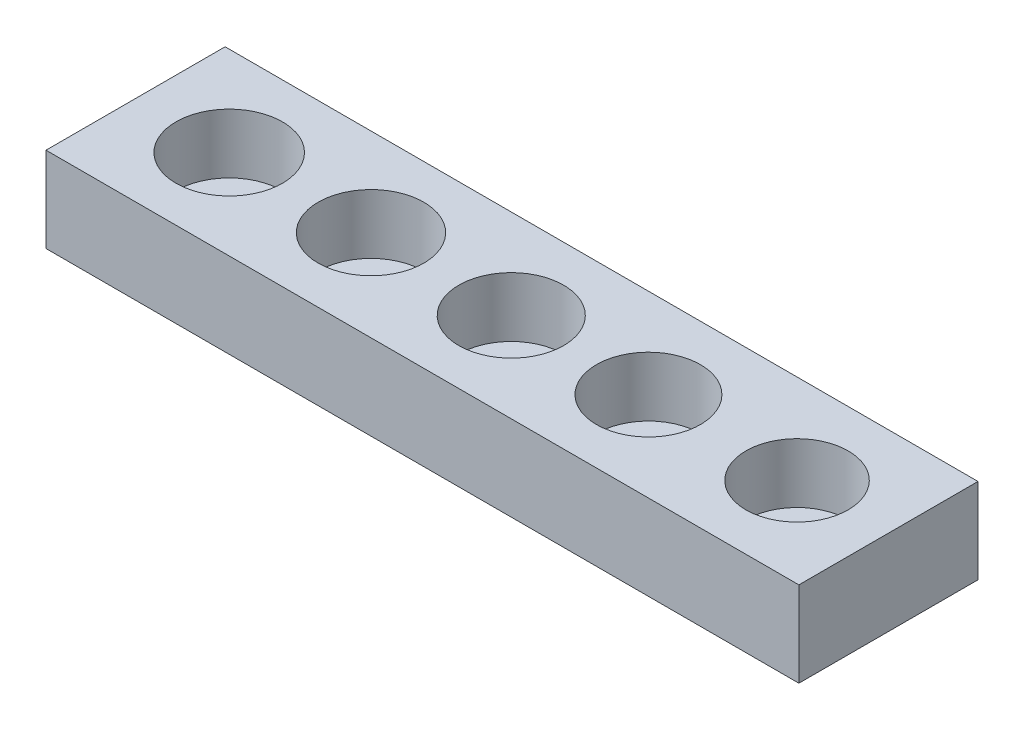
from build123d import *

# Parameters (mm, degrees)
SKETCH4_W           = 44.183790648
SKETCH4_H           = 10.51168125
BOSS_EXTRUDE1_DEPTH = 5
SKETCH5_R           = 3.125
SKETCH5_R_2         = 3.1
SKETCH5_R_3         = 3.075
SKETCH5_R_4         = 3.05
SKETCH5_R_5         = 3
CUT_EXTRUDE1_DEPTH  = 3.5


with BuildPart() as part:
    # Sketch4 → Boss-Extrude1 (new body)
    with BuildSketch(Plane(origin=(0, 0, 0), x_dir=(1, 0, 0), z_dir=(0, 1, 0))):
        Rectangle(SKETCH4_W, SKETCH4_H)
    extrude(amount=BOSS_EXTRUDE1_DEPTH)

    # Sketch5 → Cut-Extrude1 (cut)
    with BuildSketch(Plane(origin=(0, 5, 0), x_dir=(1, 0, 0), z_dir=(0, 1, 0))):
        with Locations(Location((-16.59538934, 0, 0), (0, 0, 270))):
            Circle(SKETCH5_R)
        with Locations(Location((-8.363747216, 0.088976034, 0), (0, 0, 270))):
            Circle(SKETCH5_R_2)
        with Locations(Location((-0.044488017, 0, 0), (0, 0, 270))):
            Circle(SKETCH5_R_3)
        with Locations(Location((8.007843079, 0, 0), (0, 0, 270))):
            Circle(SKETCH5_R_4)
        with Locations(Location((16.727494433, 0, 0), (0, 0, 270))):
            Circle(SKETCH5_R_5)
    extrude(amount=-CUT_EXTRUDE1_DEPTH, mode=Mode.SUBTRACT)


solid = part.part
